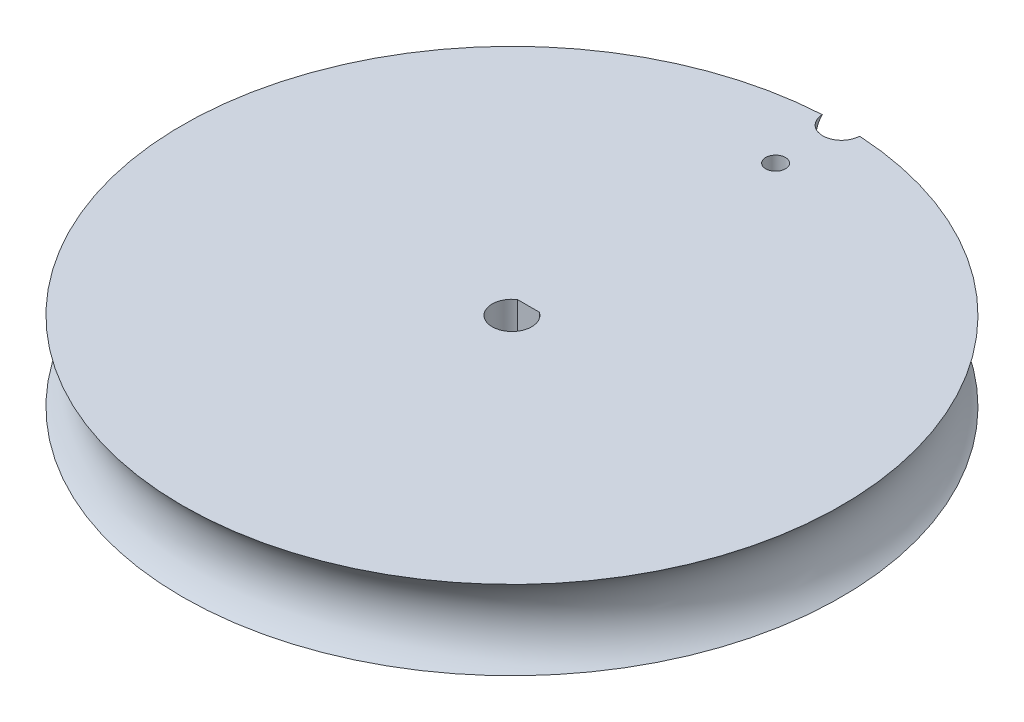
from build123d import *

# Parameters (mm, degrees)
SKETCH2_R           = 1.5
BOSS_EXTRUDE3_DEPTH = 12
SKETCH4_R           = 7.810249676


with BuildPart() as part:
    # Sketch2 → Boss-Extrude3 (new body)
    with BuildSketch(Plane(origin=(0, 0, 0), x_dir=(1, 0, 0), z_dir=(0, 1, 0))):
        with BuildLine():
            ThreePointArc((2.827295528, 49.92), (0, 47.171572875), (-2.827295528, 49.92))
            ThreePointArc((-2.827295528, 49.92), (0, -50), (2.827295528, 49.92))
        make_face()
        with BuildLine():
            ThreePointArc((1.658312395, 2.5), (0, -3), (-1.658312395, 2.5))
            Line((-1.658312395, 2.5), (1.658312395, 2.5))
        make_face(mode=Mode.SUBTRACT)
        with Locations((0, 40)):
            Circle(SKETCH2_R, mode=Mode.SUBTRACT)
    extrude(amount=BOSS_EXTRUDE3_DEPTH)

    # Sketch4 → Cut-Revolve1 (revolve, cut)
    with BuildSketch(Plane.XY):
        with Locations((55, 6)):
            Circle(SKETCH4_R)
    revolve(axis=Axis((0, 0, 0), (0, 1, 0)), mode=Mode.SUBTRACT)


solid = part.part
